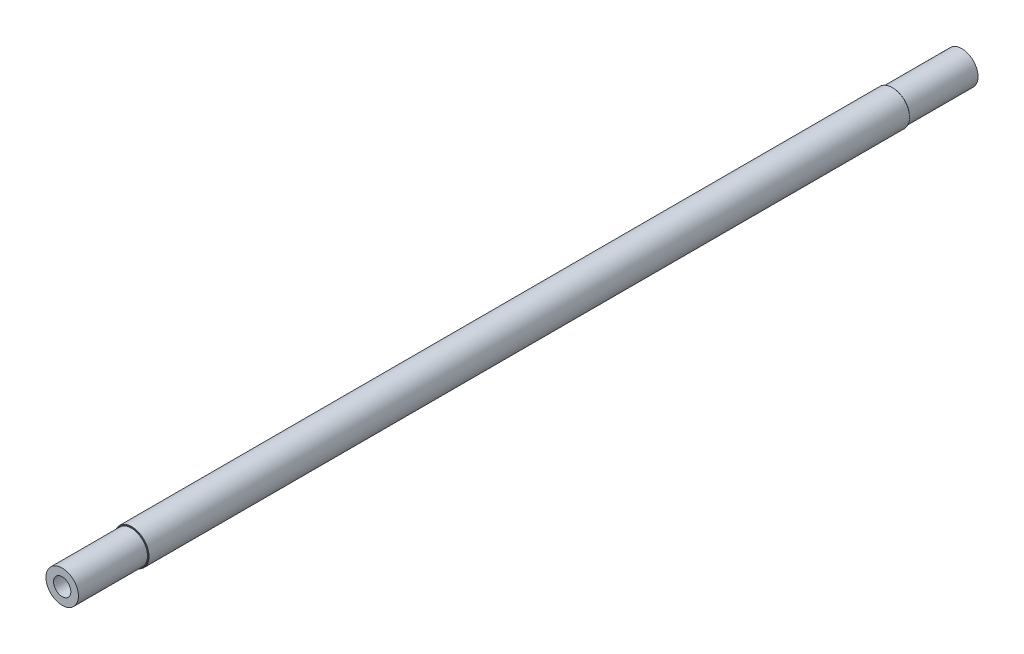
from build123d import *

# Parameters (mm, degrees)
SKETCH_1_R          = 40
SKETCH_1_R_2        = 20
EXTRUDE_1_DEPTH     = 2082
SKETCH_2_R          = 40
SKETCH_2_R_2        = 37.5
CUT_EXTRUDE_1_DEPTH = 160
CUT_EXTRUDE_START   = -160
SKETCH_3_R          = 40
SKETCH_3_R_2        = 37.5
CUT_EXTRUDE_2_DEPTH = 160
CHAMFER_1_SIZE      = 1


with BuildPart() as part:
    # 草图1 → 凸台-拉伸1 (new body)
    with BuildSketch(Plane.XY):
        Circle(SKETCH_1_R)
        Circle(SKETCH_1_R_2, mode=Mode.SUBTRACT)
    extrude(amount=EXTRUDE_1_DEPTH)

    # 草图2 → 切除-拉伸1 (cut)
    with BuildSketch(Plane(origin=(0, 0, 0), x_dir=(-1, 0, 0), z_dir=(0, 0, -1))):
        Circle(SKETCH_2_R)
        Circle(SKETCH_2_R_2, mode=Mode.SUBTRACT)
    extrude(amount=-CUT_EXTRUDE_1_DEPTH, mode=Mode.SUBTRACT)

    # 草图3 → 切除-拉伸2 (cut)
    with BuildSketch(Plane.XY.offset(2082).offset(CUT_EXTRUDE_START)):
        with Locations(Location((0, 0, 0), (0, 0, 180))):
            Circle(SKETCH_3_R)
        with Locations(Location((0, 0, 0), (0, 0, 180))):
            Circle(SKETCH_3_R_2, mode=Mode.SUBTRACT)
    extrude(amount=CUT_EXTRUDE_2_DEPTH, mode=Mode.SUBTRACT)

    # 倒角1
    chamfer_1_edges = [part.edges().sort_by_distance(p)[0] for p in [
        (-40, 0, 160),
        (-40, 0, 1922),
    ]]
    chamfer(chamfer_1_edges, length=CHAMFER_1_SIZE)


solid = part.part
